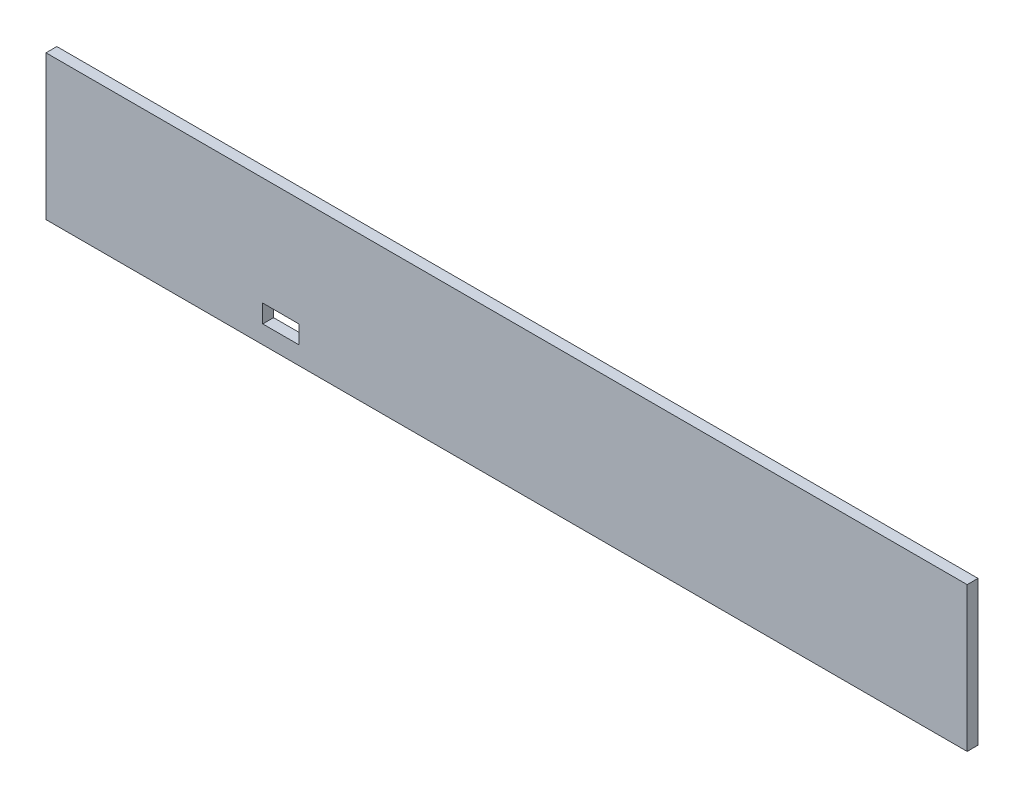
from build123d import *

# Parameters (mm, degrees)
SKETCH1_W           = 255
SKETCH1_H           = 40
SKETCH1_W_2         = 10
SKETCH1_H_2         = 5
BOSS_EXTRUDE1_DEPTH = 3


with BuildPart() as part:
    # Sketch1 → Boss-Extrude1 (new body)
    with BuildSketch(Plane.XY):
        with Locations((65.841463415, 1.126529835)):
            Rectangle(SKETCH1_W, SKETCH1_H)
        with Locations((3.341463415, -11.373470165)):
            Rectangle(SKETCH1_W_2, SKETCH1_H_2, mode=Mode.SUBTRACT)
    extrude(amount=BOSS_EXTRUDE1_DEPTH)


solid = part.part
